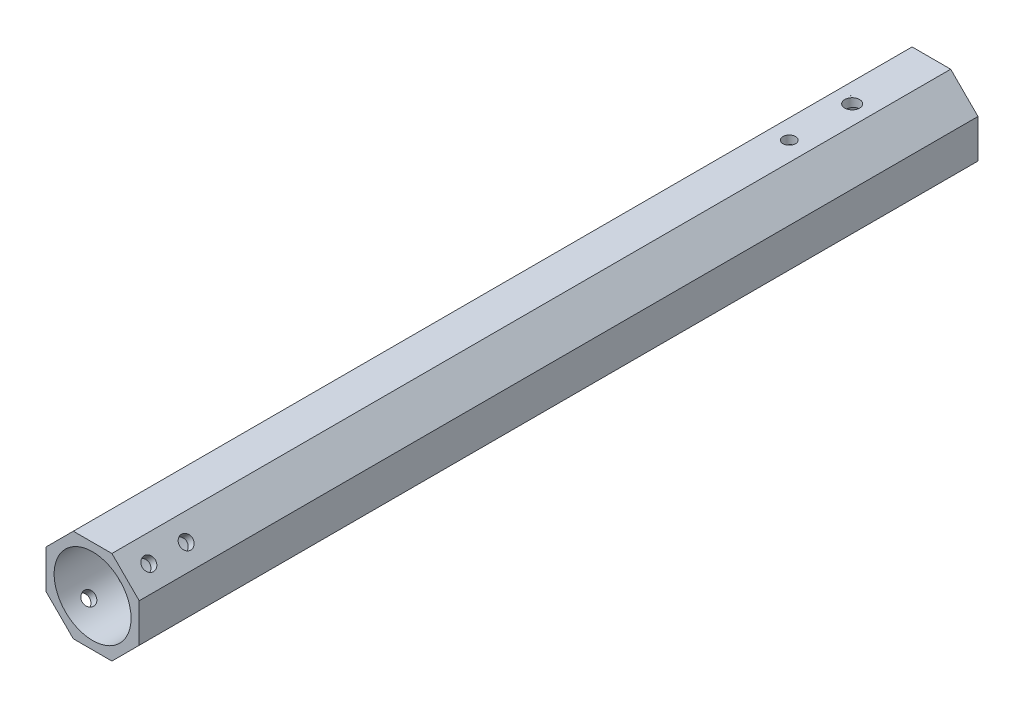
from build123d import *

# Parameters (mm, degrees)
SKETCH1_R               = 8.25
BOSS_EXTRUDE1_DEPTH     = 178
BOSS_EXTRUDE2_DEPTH     = 2
CUT_EXTRUDE1_DEPTH      = 181.554700853
CUT_EXTRUDE1_DEPTH_BACK = 181.554700853
SKETCH4_R               = 1.35
SKETCH4_R_2             = 1.6
SKETCH6_R               = 1.4
CUT_EXTRUDE2_DEPTH      = 182.611791236
CIRPATTERN1_COUNT       = 2
CIRPATTERN1_ANGLE       = 270
SKETCH7_R               = 6.269832862
CUT_EXTRUDE3_DEPTH      = 181.554700958


with BuildPart() as part:
    # Sketch1 → Boss-Extrude1 (new body)
    with BuildSketch(Plane.XY):
        Polygon((10, 4.142135624), (4.142135624, 10), (-4.142135624, 10), (-10, 4.142135624), (-10, -4.142135624), (-4.142135624, -10), (4.142135624, -10), (10, -4.142135624), align=None)
        Circle(SKETCH1_R, mode=Mode.SUBTRACT)
    extrude(amount=-BOSS_EXTRUDE1_DEPTH)

    # Sketch2 → Boss-Extrude2 (add)
    with BuildSketch(Plane(origin=(0, 0, -178), x_dir=(-1, 0, 0), z_dir=(0, 0, -1))):
        Polygon((-10, 4.142135624), (-10, -4.142135624), (-4.142135624, -10), (4.142135624, -10), (10, -4.142135624), (10, 4.142135624), (4.142135624, 10), (-4.142135624, 10), align=None)
    extrude(amount=BOSS_EXTRUDE2_DEPTH)

    # Sketch4 → Cut-Extrude1 (cut, two sides: drawn at the far end of the back side and taken through both)
    with BuildSketch(Plane(origin=(0, 0, 0), x_dir=(1, 0, 0), z_dir=(0, 1, 0)).offset(-CUT_EXTRUDE1_DEPTH_BACK)):
        with Locations(Location((0, 149.5, 0), (0, 0, 270))):
            Circle(SKETCH4_R)
        with Locations(Location((0, 163, 0), (0, 0, 270))):
            Circle(SKETCH4_R_2)
    extrude(amount=CUT_EXTRUDE1_DEPTH + CUT_EXTRUDE1_DEPTH_BACK, mode=Mode.SUBTRACT)

    # Sketch6 → Cut-Extrude2 (cut, through all)
    with BuildSketch(Plane(origin=(-7.071067812, 7.071067812, 0), x_dir=(0, 0, 1), z_dir=(-0.7071067811865476, 0.7071067811865476, 0))):
        with Locations(Location((-13, 0, 0), (0, 0, 270))):
            Circle(SKETCH6_R)
        with Locations(Location((-5, 0, 0), (0, 0, 270))):
            Circle(SKETCH6_R)
    cut_extrude2 = extrude(amount=-CUT_EXTRUDE2_DEPTH, mode=Mode.SUBTRACT)

    # CirPattern1: Cut-Extrude2 ×2 about axis
    cirpattern1_axis = Axis((0, 0, 6.85), (0, 0, -1))
    for i in range(1, CIRPATTERN1_COUNT):
        add(cut_extrude2.rotate(cirpattern1_axis, i * CIRPATTERN1_ANGLE / (CIRPATTERN1_COUNT - 1)), mode=Mode.SUBTRACT)

    # Sketch7 → Cut-Extrude3 (cut, through all)
    with BuildSketch(Plane(origin=(0, 0, -180), x_dir=(-1, 0, 0), z_dir=(0, 0, -1))):
        Circle(SKETCH7_R)
    extrude(amount=-CUT_EXTRUDE3_DEPTH, mode=Mode.SUBTRACT)


solid = part.part
